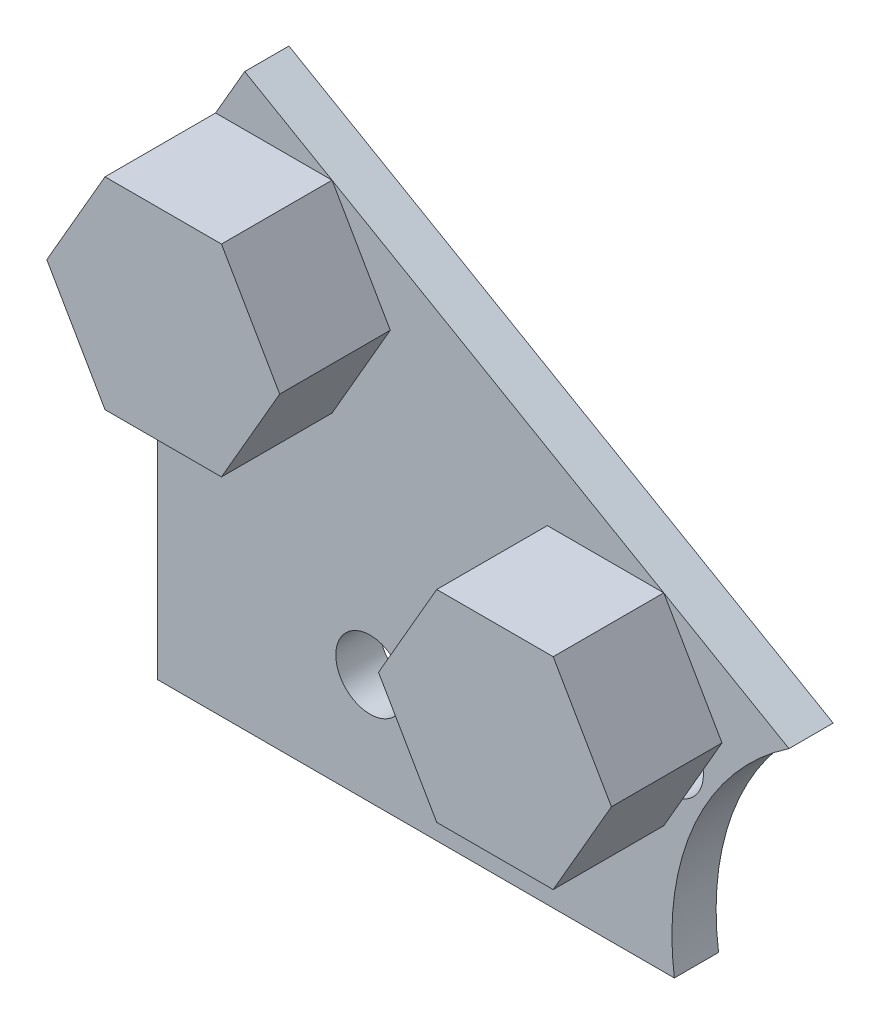
from build123d import *

# Parameters (mm, degrees)
BOSS_EXTRU_1_DEPTH      = 5
BOSS_EXTRU_1_2_DEPTH    = 5
ESQUISSE2_R             = 1.55
BOSS_EXTRU_2_DEPTH      = 2
ESQUISSE4_R             = 12
ENL_V_MAT_EXTRU_2_DEPTH = 44.039750469


with BuildPart() as part:
    # Esquisse1 → Boss.-Extru.1 (new body)
    with BuildSketch(Plane.XY):
        Polygon((-9.734272207, 8.660254038), (-12.367136104, 13.220508076), (-17.632863896, 13.220508076), (-20.265727793, 8.660254038), (-17.632863896, 4.1), (-12.367136104, 4.1), align=None)
    extrude(amount=BOSS_EXTRU_1_DEPTH)



with BuildPart() as body_2:
    # Esquisse1 → Boss.-Extru.1 2 (new body)
    with BuildSketch(Plane.XY):
        Polygon((-32.632863896, 21.880762114), (-35.265727793, 17.320508076), (-32.632863896, 12.760254038), (-27.367136104, 12.760254038), (-24.734272207, 17.320508076), (-27.367136104, 21.880762114), align=None)
    extrude(amount=BOSS_EXTRU_1_2_DEPTH)


with BuildPart() as part_1:
    add(part.part)

    add(body_2.part)  # Boss.-Extru.2 merges body 2
    # Esquisse2 → Boss.-Extru.2 (add)
    with BuildSketch(Plane.XY):
        Polygon((-31.316431948, 24.160889132), (-12.367136104, 13.220508076), (-4.867136104, 8.890381057), (-10.937308897, -1.623466631), (-35.265727793, -1.623466631), (-35.265727793, 17.320508076), align=None)
        with Locations((-12.124355653, 7)):
            Circle(ESQUISSE2_R, mode=Mode.SUBTRACT)
        with Locations((-29.270783852, 16.899494937)):
            Circle(ESQUISSE2_R, mode=Mode.SUBTRACT)
        with Locations((-25.647317221, 3.376533369)):
            Circle(ESQUISSE2_R, mode=Mode.SUBTRACT)
    extrude(amount=-BOSS_EXTRU_2_DEPTH)

    # Esquisse4 → Enlèv. mat.-Extru.2 (cut, through all)
    with BuildSketch(Plane.XY):
        Circle(ESQUISSE4_R)
    extrude(amount=-ENL_V_MAT_EXTRU_2_DEPTH, mode=Mode.SUBTRACT)


solid = part_1.part
